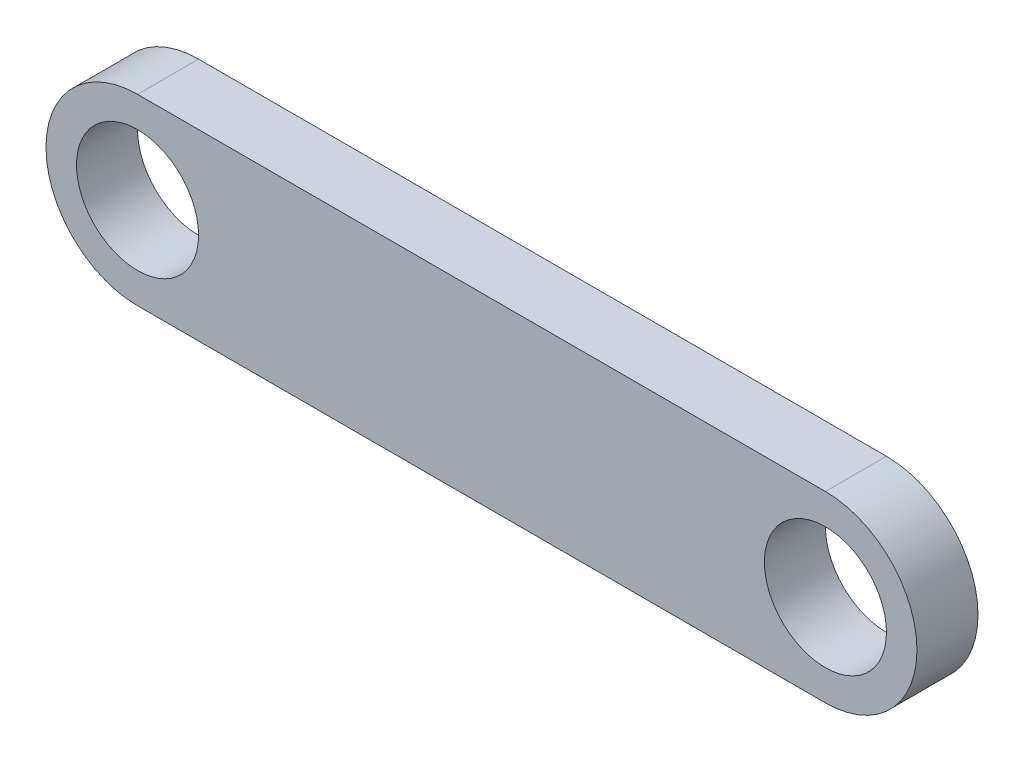
from build123d import *

# Parameters (mm, degrees)
SKETCH1_R           = 1
BOSS_EXTRUDE1_DEPTH = 0.5


with BuildPart() as part:
    # Sketch1 → Boss-Extrude1 (new, symmetric)
    with BuildSketch(Plane.XY):
        with BuildLine():
            Line((0, -1.5), (-11.2709, -1.5))
            ThreePointArc((-11.2709, -1.5), (-12.7709, 0), (-11.2709, 1.5))
            Line((-11.2709, 1.5), (0, 1.5))
            ThreePointArc((0, 1.5), (1.5, 0), (0, -1.5))
        make_face()
        with Locations((-11.2709, 0)):
            Circle(SKETCH1_R, mode=Mode.SUBTRACT)
        Circle(SKETCH1_R, mode=Mode.SUBTRACT)
    extrude(amount=BOSS_EXTRUDE1_DEPTH, both=True)


solid = part.part
